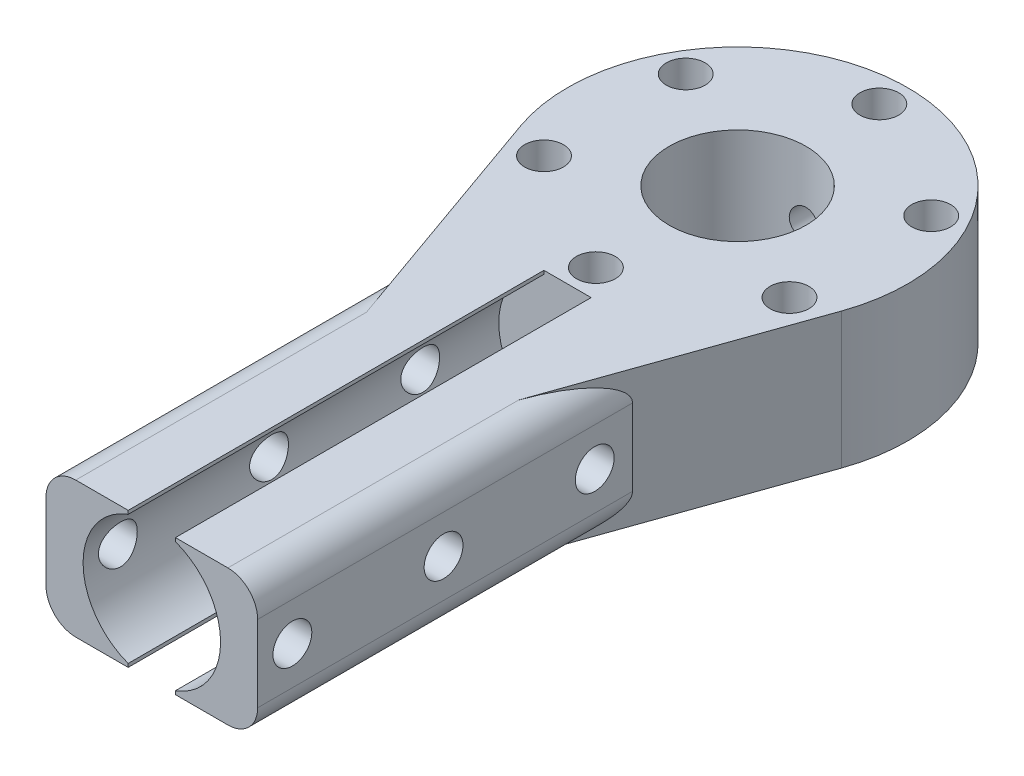
from build123d import *

# Parameters (mm, degrees)
SKETCH3_R               = 11.5
SKETCH3_R_2             = 3.2639
BOSS_EXTRUDE1_DEPTH     = 22.86
CUT_EXTRUDE1_DEPTH      = 69.85
SKETCH6_R               = 3.2639
CUT_EXTRUDE2_DEPTH      = 112.17034789
FILLET1_R               = 5
CUT_EXTRUDE4_REACH      = 97.698
CUT_EXTRUDE4_END_RADIUS = 28.575
SKETCH8_R               = 2.54


with BuildPart() as part:
    # Sketch3 → Boss-Extrude1 (new body)
    with BuildSketch(Plane(origin=(0, 0, 0), x_dir=(1, 0, 0), z_dir=(0, 1, 0))):
        with BuildLine():
            Line((-26.940768363, -9.525), (-17.78, -35.435565722))
            Line((-17.78, -35.435565722), (-17.78, -98.425))
            Line((-17.78, -98.425), (17.78, -98.425))
            Line((17.78, -98.425), (17.78, -35.435565722))
            Line((17.78, -35.435565722), (26.940768363, -9.525))
            ThreePointArc((26.940768363, -9.525), (0, 28.575), (-26.940768363, -9.525))
        make_face()
        with Locations(Location((0, 0, 0), (0, 0, 270))):
            Circle(SKETCH3_R, mode=Mode.SUBTRACT)
        with Locations(Location((0, 23.8125, 0), (0, 0, 270))):
            Circle(SKETCH3_R_2, mode=Mode.SUBTRACT)
        with Locations(Location((20.622229928, 11.90625, 0), (0, 0, 270))):
            Circle(SKETCH3_R_2, mode=Mode.SUBTRACT)
        with Locations(Location((20.622229928, -11.90625, 0), (0, 0, 270))):
            Circle(SKETCH3_R_2, mode=Mode.SUBTRACT)
        with Locations(Location((0, -23.8125, 0), (0, 0, 270))):
            Circle(SKETCH3_R_2, mode=Mode.SUBTRACT)
        with Locations(Location((-20.622229928, -11.90625, 0), (0, 0, 270))):
            Circle(SKETCH3_R_2, mode=Mode.SUBTRACT)
        with Locations(Location((-20.622229928, 11.90625, 0), (0, 0, 270))):
            Circle(SKETCH3_R_2, mode=Mode.SUBTRACT)
    extrude(amount=BOSS_EXTRUDE1_DEPTH)

    # Sketch4 → Cut-Extrude1 (cut)
    with BuildSketch(Plane.XY.offset(98.425)):
        with BuildLine():
            Line((3.96875, 0), (-3.96875, 0))
            Line((-3.96875, 0), (-3.96875, 0.583271302))
            ThreePointArc((-3.96875, 0.583271302), (-11.55, 11.43), (-3.96875, 22.276728698))
            Line((-3.96875, 22.276728698), (-3.96875, 22.86))
            Line((-3.96875, 22.86), (3.96875, 22.86))
            Line((3.96875, 22.86), (3.96875, 22.276728698))
            ThreePointArc((3.96875, 22.276728698), (11.55, 11.43), (3.96875, 0.583271302))
            Line((3.96875, 0.583271302), (3.96875, 0))
        make_face()
    extrude(amount=-CUT_EXTRUDE1_DEPTH, mode=Mode.SUBTRACT)

    # Sketch6 → Cut-Extrude2 (cut, through all)
    with BuildSketch(Plane(origin=(17.78, 0, 0), x_dir=(0, 0, -1), z_dir=(1, 0, 0))):
        with Locations((-41.785565722, 11.43)):
            Circle(SKETCH6_R)
        with Locations((-67.185565722, 11.43)):
            Circle(SKETCH6_R)
        with Locations((-92.585565722, 11.43)):
            Circle(SKETCH6_R)
    extrude(amount=-CUT_EXTRUDE2_DEPTH, mode=Mode.SUBTRACT)

    # Fillet1
    fillet1_edges = [part.edges().sort_by_distance(p)[0] for p in [
        (-17.78, 22.86, 66.930282861),
        (17.78, 22.86, 66.930282861),
        (-17.78, 0, 66.930282861),
        (17.78, 0, 66.930282861),
    ]]
    fillet(fillet1_edges, radius=FILLET1_R)

    # Cut-Extrude4: up to this cylinder (the profile starts inside it)
    cut_extrude4_end = Plane(origin=(0, 11.43, 0), z_dir=(0, -1, 0)) * Cylinder(CUT_EXTRUDE4_END_RADIUS, 253.546, mode=Mode.PRIVATE)
    # Sketch8 → Cut-Extrude4 (cut, up to the surface)
    with BuildSketch(Plane.XY.offset(10), mode=Mode.PRIVATE) as cut_extrude4_sk1:
        with Locations(Location((0, 11.43, 0), (0, 0, 90))):
            Circle(SKETCH8_R)
    cut_extrude4_tool1 = extrude(cut_extrude4_sk1.sketch, amount=-CUT_EXTRUDE4_REACH, mode=Mode.PRIVATE) & cut_extrude4_end
    add(cut_extrude4_tool1.solids().sort_by_distance((0, 11.43, 10))[0], mode=Mode.SUBTRACT)


solid = part.part
